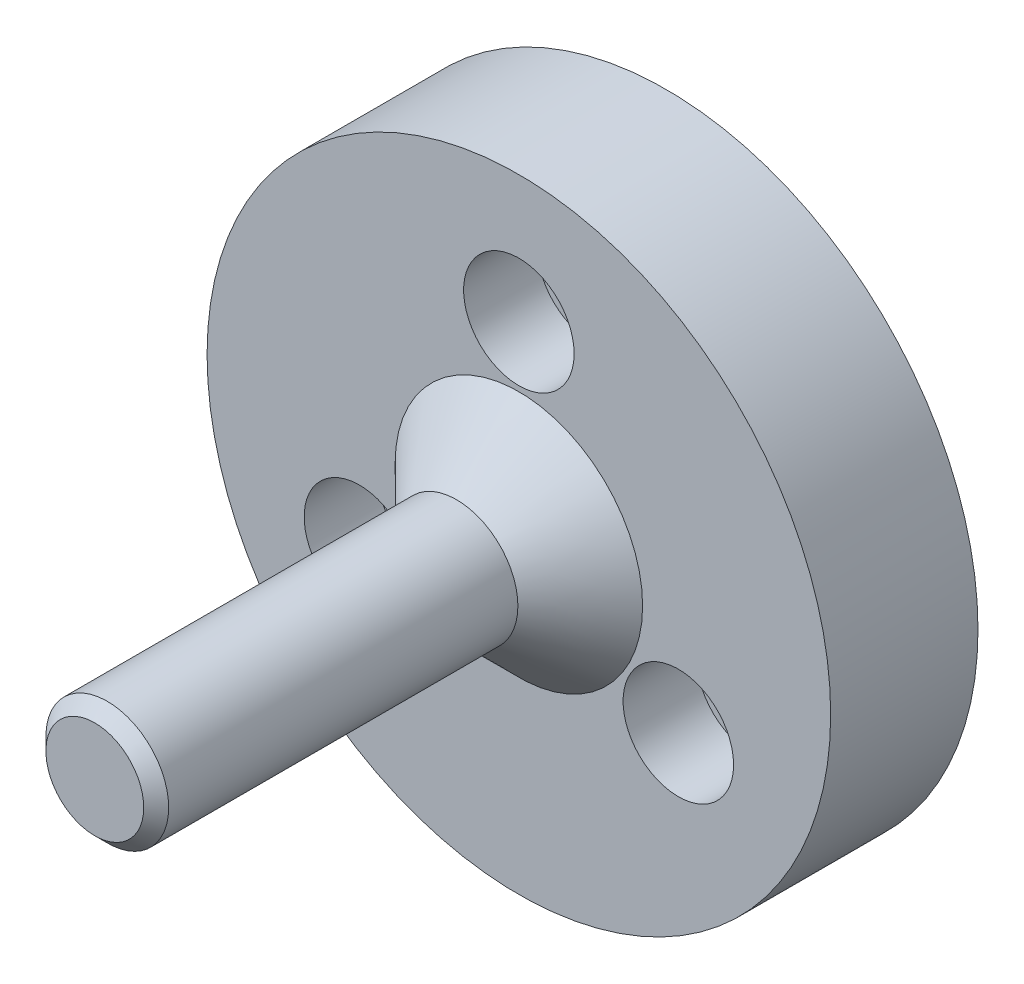
from build123d import *

# Parameters (mm, degrees)
SKETCH1_R                    = 12.7
MOUNTING_FLANGE_DEPTH        = 6
SKETCH3_R                    = 6.35
MOTOR_SHAFT_RELIEF_DEPTH     = 2.54
SKETCH4_R                    = 1.45
SCREW_CLEARANCE_HOLES_DEPTH  = 19.936208702
SKETCH6_R                    = 2.25
SCREW_HEAD_COUNTERBORE_DEPTH = 3
SKETCH2_R                    = 2.5
BOSS_EXTRUDE1_DEPTH          = 17.272
CHAMFER1_SIZE                = 0.508
CHAMFER2_SIZE                = 2.54


with BuildPart() as part:
    # Sketch1 → Mounting Flange (new body)
    with BuildSketch(Plane.XY):
        Circle(SKETCH1_R)
    extrude(amount=MOUNTING_FLANGE_DEPTH)

    # Sketch3 → Motor Shaft Relief (cut)
    with BuildSketch(Plane(origin=(0, 0, 0), x_dir=(-1, 0, 0), z_dir=(0, 0, -1))):
        Circle(SKETCH3_R)
    extrude(amount=-MOTOR_SHAFT_RELIEF_DEPTH, mode=Mode.SUBTRACT)

    # Sketch4 → Screw Clearance Holes (cut, through all)
    with BuildSketch(Plane.XY.offset(6)):
        with Locations((0, 7.5)):
            Circle(SKETCH4_R)
        with Locations((6.495190528, -3.75)):
            Circle(SKETCH4_R)
        with Locations((-6.495190528, -3.75)):
            Circle(SKETCH4_R)
    extrude(amount=-SCREW_CLEARANCE_HOLES_DEPTH, mode=Mode.SUBTRACT)

    # Sketch6 → Screw Head Counterbore (cut)
    with BuildSketch(Plane.XY.offset(6)):
        with Locations((0, 7.5)):
            Circle(SKETCH6_R)
        with Locations((-6.495190528, -3.75)):
            Circle(SKETCH6_R)
        with Locations((6.495190528, -3.75)):
            Circle(SKETCH6_R)
    extrude(amount=-SCREW_HEAD_COUNTERBORE_DEPTH, mode=Mode.SUBTRACT)

    # Sketch2 → Boss-Extrude1 (add)
    with BuildSketch(Plane.XY.offset(6)):
        Circle(SKETCH2_R)
    extrude(amount=BOSS_EXTRUDE1_DEPTH)

    # Chamfer1
    chamfer1_edges = [part.edges().sort_by_distance(p)[0] for p in [
        (-2.5, 0, 23.272),
    ]]
    chamfer(chamfer1_edges, length=CHAMFER1_SIZE)

    # Chamfer2
    chamfer2_edges = [part.edges().sort_by_distance(p)[0] for p in [
        (-2.5, 0, 6),
    ]]
    chamfer(chamfer2_edges, length=CHAMFER2_SIZE)


solid = part.part
